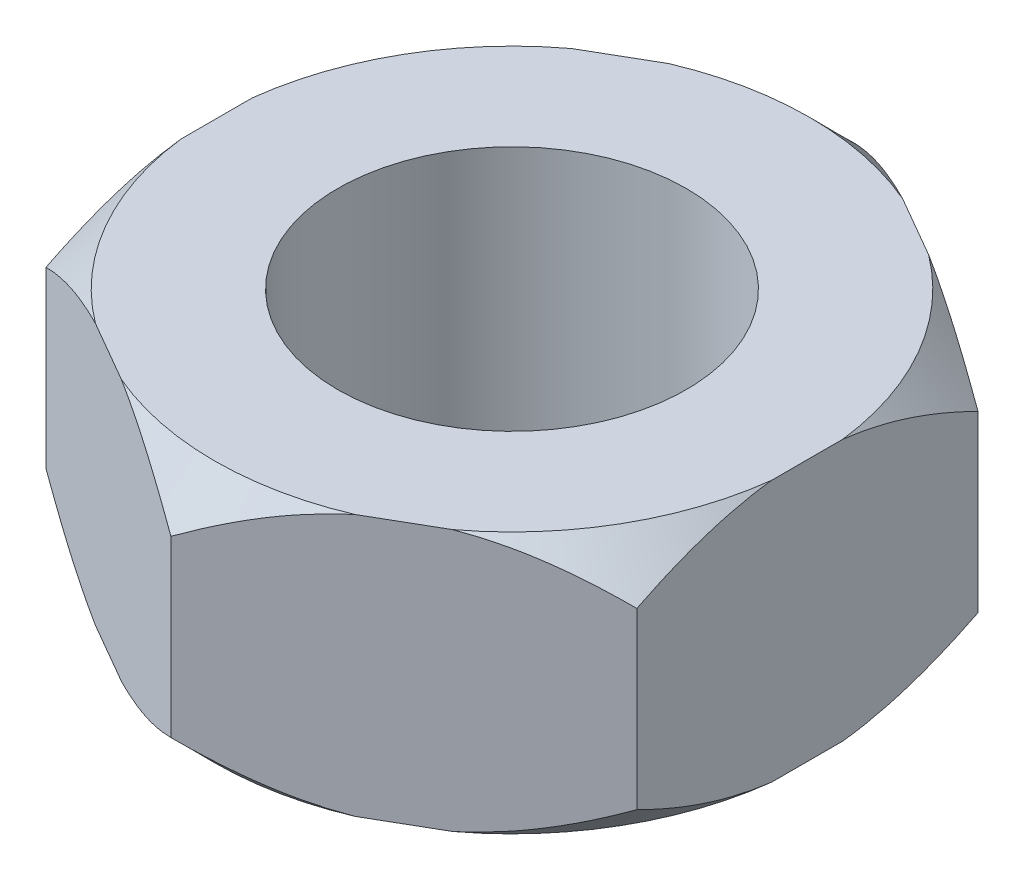
from build123d import *

# Parameters (mm, degrees)
SKETCH_1_R      = 2
EXTRUDE_1_DEPTH = 3


with BuildPart() as part:
    # 草图1 → 凸台-拉伸1 (new body)
    with BuildSketch(Plane(origin=(0, 0, 0), x_dir=(1, 0, 0), z_dir=(0, 1, 0))):
        Polygon((0, 3.914434825), (-3.39, 1.957217413), (-3.39, -1.957217413), (0, -3.914434825), (3.39, -1.957217413), (3.39, 1.957217413), align=None)
        with Locations(Location((0, 0, 0), (0, 0, 270))):
            Circle(SKETCH_1_R, mode=Mode.SUBTRACT)
    extrude(amount=EXTRUDE_1_DEPTH)

    # 草图12 → 切除-旋转1 (revolve, cut)
    with BuildSketch(Plane(origin=(0, 0, 0), x_dir=(-0.8660254037844386, 0, -0.5000000000000003), z_dir=(0.5000000000000002, 0, -0.8660254037844385))):
        Polygon((-3.414434825, 3), (-3.914434825, 2.5), (-3.914434825, 3), align=None)
    cut_revolve_1 = revolve(axis=Axis((0, 3, 0), (0, 1, 0)), mode=Mode.SUBTRACT)

    # 镜向1: 切除-旋转1 across plane
    add(cut_revolve_1.mirror(Plane.ZX.offset(1.5)), mode=Mode.SUBTRACT)


solid = part.part
